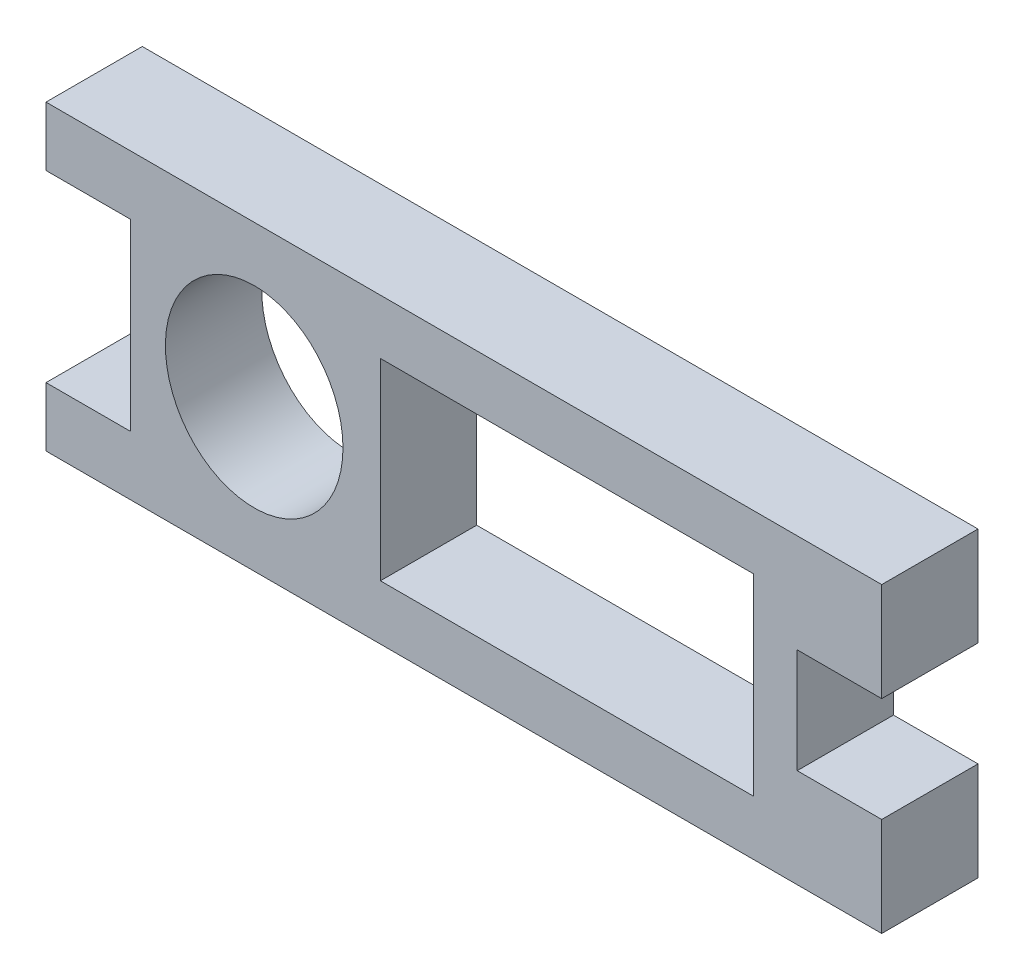
from build123d import *

# Parameters (mm, degrees)
BOSS_EXTRUDE1_DEPTH = 5.85


with BuildPart() as part:
    # Sketch1 → Boss-Extrude1 (new body)
    with BuildSketch(Plane.XY):
        Polygon((717.409183992, 393.715790859), (717.409183992, 382.557692719), (712.274960252, 382.557692719), (712.274960252, 378.957692719), (717.409183992, 378.957692719), (757.909183992, 378.957692719), (763.043407733, 378.957692719), (763.043407733, 384.957692719), (757.909183992, 384.957692719), (757.909183992, 391.315790859), (763.043407733, 391.315790859), (763.043407733, 397.315790859), (757.909183992, 397.315790859), (717.409183992, 397.315790859), (712.274960252, 397.315790859), (712.274960252, 393.715790859), align=None)
        with BuildLine():
            add(Edge.make_bspline(
                [(724.922370371, 393.986741789), (715.580462156, 393.986741789), (720.251416264, 385.211741789), (724.922370371, 376.436741789), (729.593324478, 385.211741789), (734.264278586, 393.986741789), (724.922370371, 393.986741789)],
                knots=[0, 0, 0, 2.094395102, 2.094395102, 4.188790205, 4.188790205, 6.283185307, 6.283185307, 6.283185307], degree=2, weights=[1, 0.5, 1, 0.5, 1, 0.5, 1]))
        make_face(mode=Mode.SUBTRACT)
        Polygon((755.259186992, 393.986741789), (755.259186992, 382.286741789), (738.159186992, 382.286741789), (732.589695742, 382.286741789), (732.589695742, 393.986741789), (738.159186992, 393.986741789), align=None, mode=Mode.SUBTRACT)
    extrude(amount=BOSS_EXTRUDE1_DEPTH)


solid = part.part
